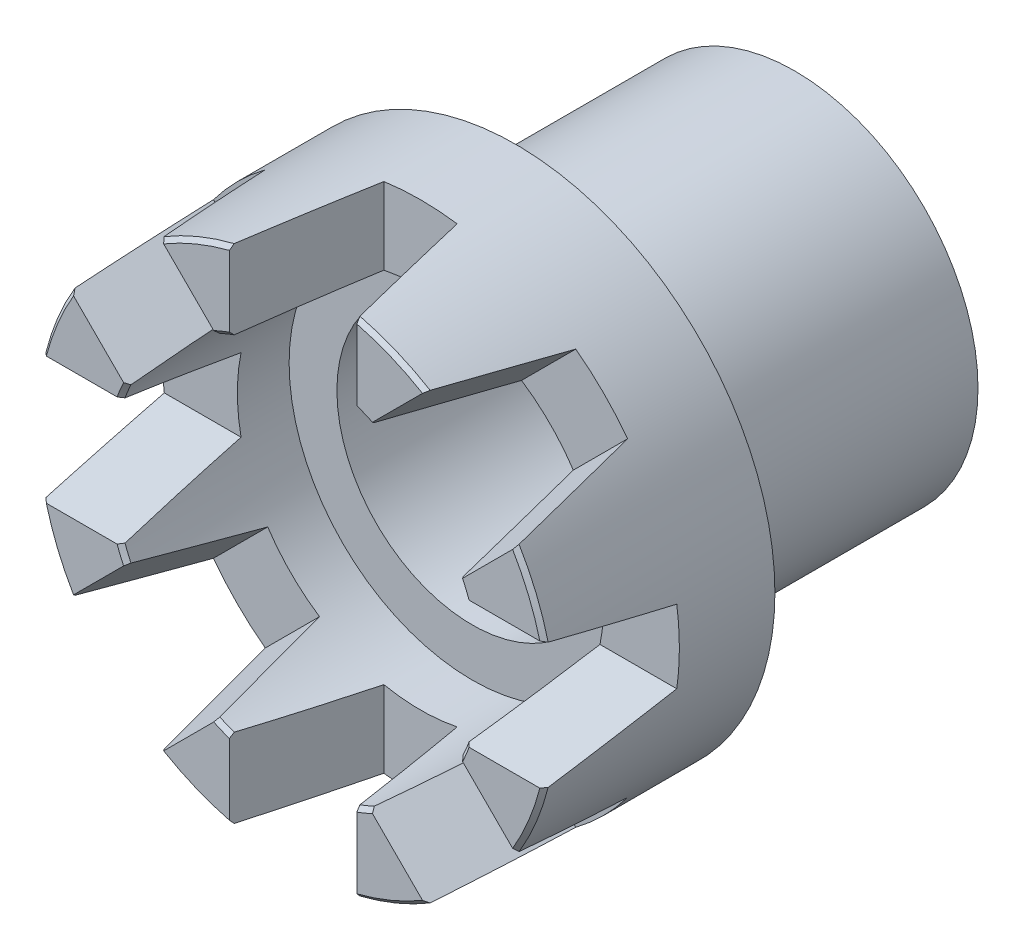
from build123d import *

# Parameters (mm, degrees)
CHAMFER_1_SIZE           = 1
CUT_EXTRUDE_1_DEPTH      = 65
PATTERN_CIRCULAR_1_COUNT = 8


with BuildPart() as part:
    # Эскиз1 → Повернуть1 (revolve)
    with BuildSketch(Plane(origin=(0, 0, 0), x_dir=(0, 0, -1), z_dir=(1, 0, 0))):
        Polygon((0, 46), (0, 65), (56, 65), (56, 46), (126, 46), (126, 32), (123, 32), (123, 34), (45, 34), (45, 46), align=None)
    revolve(axis=Axis((0, 0, 0), (0, 0, -1)))

    # Фаска1
    chamfer_1_edges = [part.edges().sort_by_distance(p)[0] for p in [
        (0, -65, 0),
        (0, -46, 0),
    ]]
    chamfer(chamfer_1_edges, length=CHAMFER_1_SIZE)

    # Эскиз2 → Вырез-Вытянуть1 (cut)
    with BuildSketch(Plane(origin=(0, 65, -28), x_dir=(-1, 0, 0), z_dir=(0, 1, 0))):
        Polygon((16, 28), (-16, 28), (-9.198190027, -4), (9.198190027, -4), align=None)
    cut_extrude_1 = extrude(amount=-CUT_EXTRUDE_1_DEPTH, mode=Mode.SUBTRACT)

    # Круговой массив1: Вырез-Вытянуть1 ×8 about axis
    pattern_circular_1_axis = Axis((0, 0, -45), (0, 0, 1))
    for i in range(1, PATTERN_CIRCULAR_1_COUNT):
        add(cut_extrude_1.rotate(pattern_circular_1_axis, i * 360 / PATTERN_CIRCULAR_1_COUNT), mode=Mode.SUBTRACT)


solid = part.part
